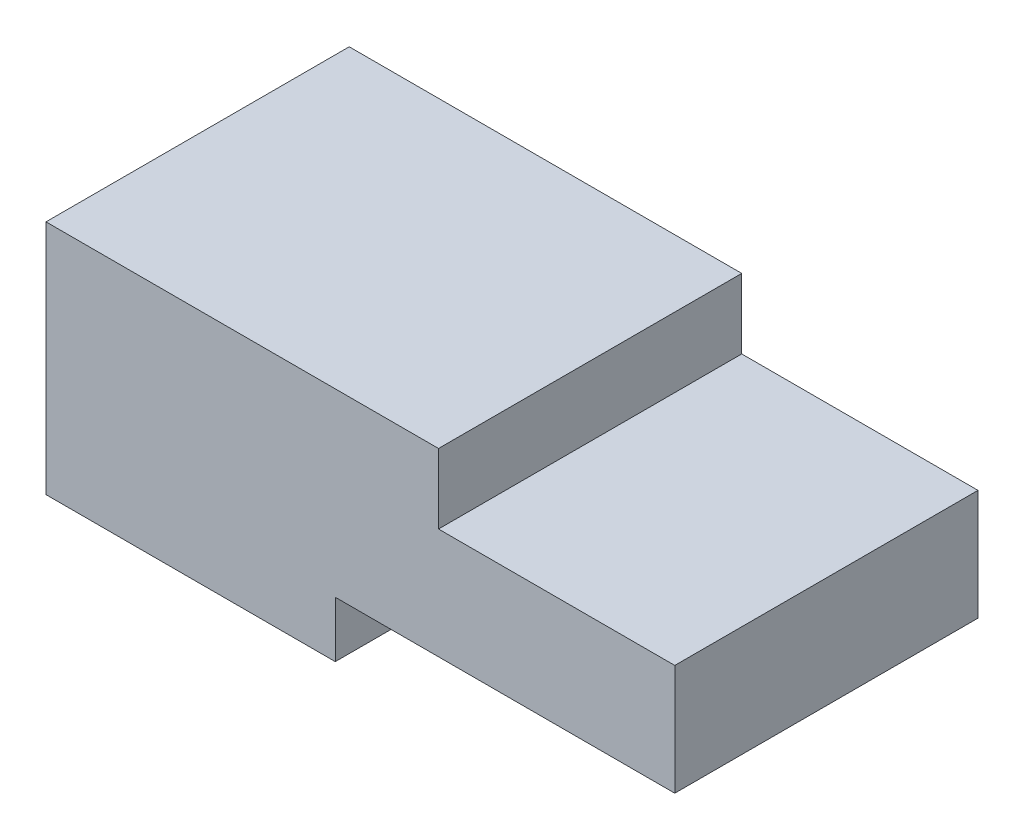
from build123d import *

# Parameters (mm, degrees)
SKETCH1_W           = 33.8
SKETCH1_H           = 16.3
BOSS_EXTRUDE1_DEPTH = 12.7
SKETCH2_W           = 18.25
SKETCH2_H           = 3
SKETCH2_W_2         = 12.7
SKETCH2_H_2         = 3.75
CUT_EXTRUDE1_DEPTH  = 40.615905896


with BuildPart() as part:
    # Sketch1 → Boss-Extrude1 (new body)
    with BuildSketch(Plane(origin=(0, 0, 0), x_dir=(1, 0, 0), z_dir=(0, 1, 0))):
        with Locations((16.9, 8.15)):
            Rectangle(SKETCH1_W, SKETCH1_H)
    extrude(amount=-BOSS_EXTRUDE1_DEPTH)

    # Sketch2 → Cut-Extrude1 (cut, through all)
    with BuildSketch(Plane.XY):
        with Locations((24.675, -11.2)):
            Rectangle(SKETCH2_W, SKETCH2_H)
        with Locations((27.45, -1.875)):
            Rectangle(SKETCH2_W_2, SKETCH2_H_2)
    extrude(amount=-CUT_EXTRUDE1_DEPTH, mode=Mode.SUBTRACT)


solid = part.part
